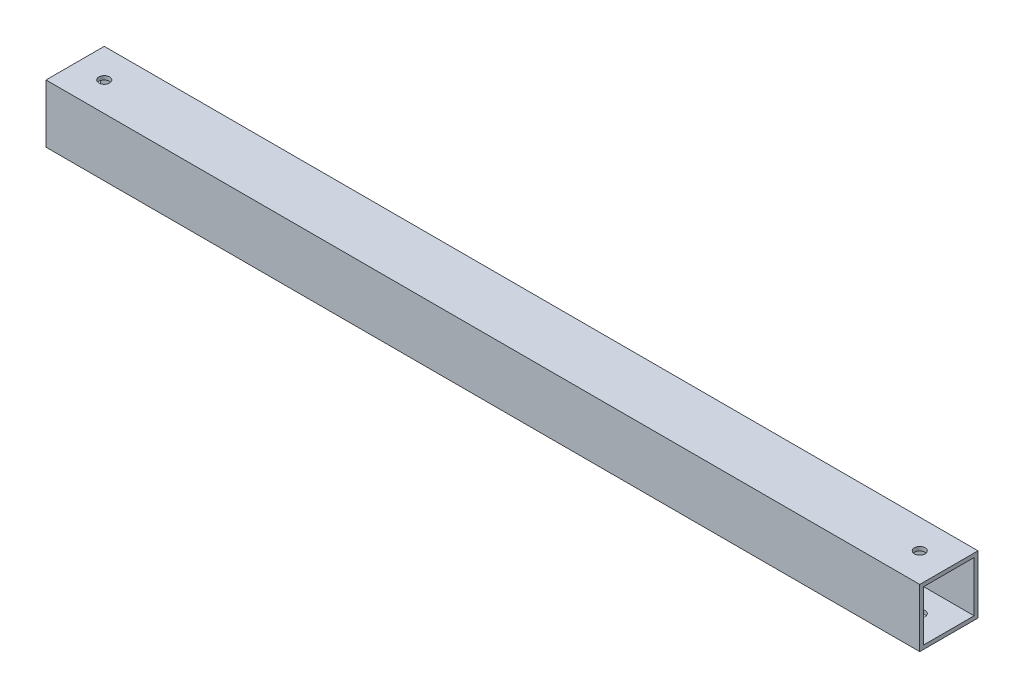
from build123d import *

# Parameters (mm, degrees)
SKETCH1_W           = 30
SKETCH1_H           = 30
SKETCH1_W_2         = 26
SKETCH1_H_2         = 26
BOSS_EXTRUDE1_DEPTH = 225
SKETCH2_R           = 2.75
CUT_EXTRUDE1_DEPTH  = 226.9977876


with BuildPart() as part:
    # Sketch1 → Boss-Extrude1 (new, symmetric)
    with BuildSketch(Plane(origin=(0, 0, 0), x_dir=(0, 0, -1), z_dir=(1, 0, 0))):
        Rectangle(SKETCH1_W, SKETCH1_H)
        Rectangle(SKETCH1_W_2, SKETCH1_H_2, mode=Mode.SUBTRACT)
    extrude(amount=BOSS_EXTRUDE1_DEPTH, both=True)

    # Sketch2 → Cut-Extrude1 (cut, symmetric)
    with BuildSketch(Plane(origin=(0, 0, 0), x_dir=(1, 0, 0), z_dir=(0, 1, 0))):
        with Locations(Location((210, 0, 0), (0, 0, 270))):
            Circle(SKETCH2_R)
    cut_extrude1 = extrude(amount=CUT_EXTRUDE1_DEPTH, both=True, mode=Mode.SUBTRACT)

    # Mirror1: Cut-Extrude1 across plane
    add(cut_extrude1.mirror(Plane(origin=(0, 0, 0), x_dir=(0, 0, 1), z_dir=(1, 0, 0))), mode=Mode.SUBTRACT)


solid = part.part
